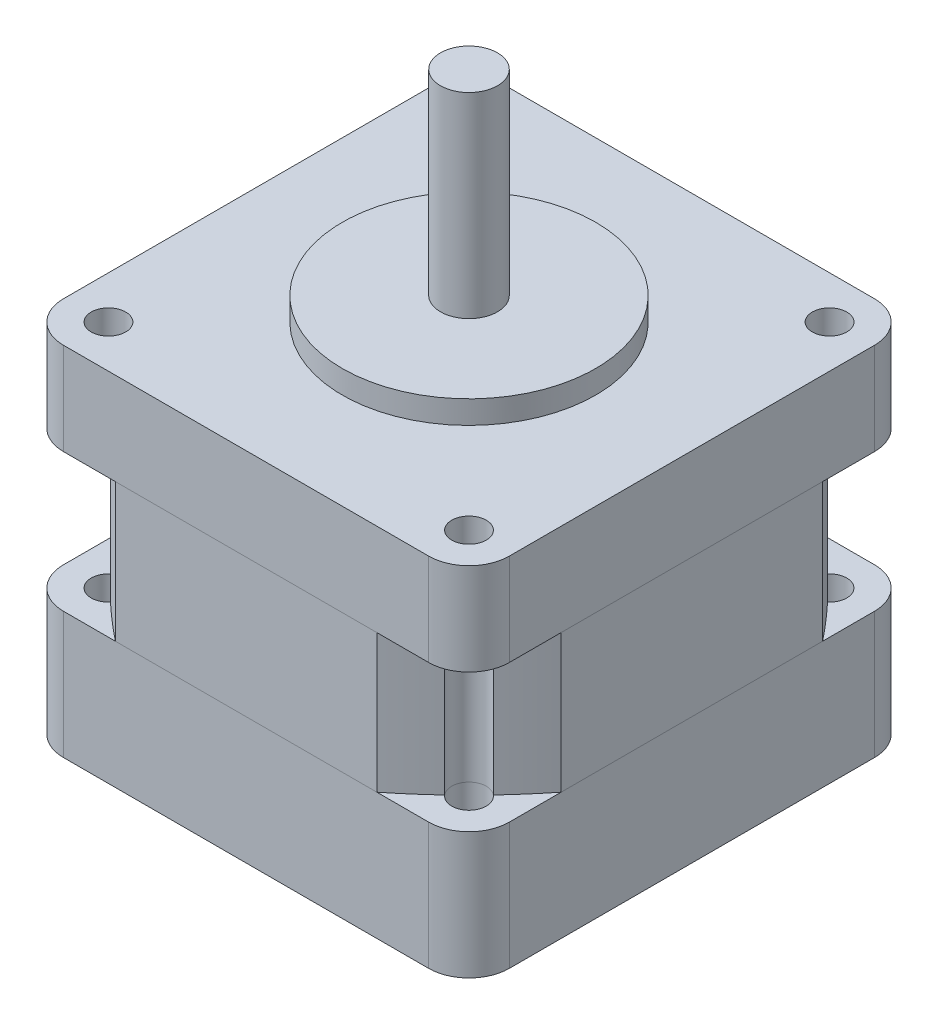
from build123d import *

# Parameters (mm, degrees)
SKETCH_1_W          = 38.7
SKETCH_1_H          = 38.7
EXTRUDE_1_DEPTH     = 11
SKETCH_2_W          = 38.7
SKETCH_2_H          = 38.7
EXTRUDE_2_DEPTH     = 12
SKETCH_3_W          = 38.7
SKETCH_3_H          = 38.7
EXTRUDE_3_DEPTH     = 8
CUT_EXTRUDE_1_DEPTH = 12
FILLET_1_R          = 3.5
FILLET_2_R          = 3.5
SKETCH_5_R          = 1.5
CUT_EXTRUDE_2_DEPTH = 42.350272067
SKETCH_6_R          = 11
EXTRUDE_4_DEPTH     = 2
SKETCH_7_R          = 2.475
EXTRUDE_5_DEPTH     = 17


with BuildPart() as part:
    # 스케치1 → 보스-돌출1 (new body)
    with BuildSketch(Plane(origin=(0, 0, 0), x_dir=(1, 0, 0), z_dir=(0, 1, 0))):
        Rectangle(SKETCH_1_W, SKETCH_1_H)
    extrude(amount=EXTRUDE_1_DEPTH)

    # 필렛2
    fillet_2_edges = [part.edges().sort_by_distance(p)[0] for p in [
        (19.35, 5.5, 19.35),
        (-19.35, 5.5, 19.35),
        (-19.35, 5.5, -19.35),
        (19.35, 5.5, -19.35),
    ]]
    fillet(fillet_2_edges, radius=FILLET_2_R)


with BuildPart() as body_2:
    # 스케치2 → 보스-돌출2 (new body)
    with BuildSketch(Plane(origin=(0, 11, 0), x_dir=(1, 0, 0), z_dir=(0, 1, 0))):
        Rectangle(SKETCH_2_W, SKETCH_2_H)
    extrude(amount=EXTRUDE_2_DEPTH)

    # 스케치4 → 컷-돌출1 (cut)
    with BuildSketch(Plane(origin=(0, 23, 0), x_dir=(1, 0, 0), z_dir=(0, 1, 0))):
        with BuildLine():
            Line((19.35, 11.35), (19.35, 19.35))
            Line((19.35, 19.35), (11.35, 19.35))
            ThreePointArc((11.35, 19.35), (15.579786716, 15.579786716), (19.35, 11.35))
        make_face()
        with BuildLine():
            Line((19.35, -11.35), (19.35, -19.35))
            Line((19.35, -19.35), (11.35, -19.35))
            ThreePointArc((11.35, -19.35), (15.579786716, -15.579786716), (19.35, -11.35))
        make_face()
        with BuildLine():
            Line((-19.35, -11.35), (-19.35, -19.35))
            Line((-19.35, -19.35), (-11.35, -19.35))
            ThreePointArc((-11.35, -19.35), (-15.579786716, -15.579786716), (-19.35, -11.35))
        make_face()
        with BuildLine():
            Line((-19.35, 11.35), (-19.35, 19.35))
            Line((-19.35, 19.35), (-11.35, 19.35))
            ThreePointArc((-11.35, 19.35), (-15.579786716, 15.579786716), (-19.35, 11.35))
        make_face()
    extrude(amount=-CUT_EXTRUDE_1_DEPTH, mode=Mode.SUBTRACT)


with BuildPart() as body_3:
    # 스케치3 → 보스-돌출3 (new body)
    with BuildSketch(Plane(origin=(0, 23, 0), x_dir=(1, 0, 0), z_dir=(0, 1, 0))):
        Rectangle(SKETCH_3_W, SKETCH_3_H)
    extrude(amount=EXTRUDE_3_DEPTH)

    # 필렛1
    fillet_1_edges = [body_3.edges().sort_by_distance(p)[0] for p in [
        (19.35, 27, 19.35),
        (-19.35, 27, 19.35),
        (-19.35, 27, -19.35),
        (19.35, 27, -19.35),
    ]]
    fillet(fillet_1_edges, radius=FILLET_1_R)


with BuildPart() as cut_extrude_2_tool:
    # 스케치5 → 컷-돌출2 (new, through all)
    with BuildSketch(Plane(origin=(0, 31, 0), x_dir=(1, 0, 0), z_dir=(0, 1, 0))):
        with Locations(Location((15.65, 15.65, 0), (0, 0, 270))):
            Circle(SKETCH_5_R)
        with Locations(Location((-15.65, 15.65, 0), (0, 0, 270))):
            Circle(SKETCH_5_R)
        with Locations(Location((-15.65, -15.65, 0), (0, 0, 270))):
            Circle(SKETCH_5_R)
        with Locations(Location((15.65, -15.65, 0), (0, 0, 270))):
            Circle(SKETCH_5_R)
    extrude(amount=-CUT_EXTRUDE_2_DEPTH)


with BuildPart() as part_1:
    add(part.part)

    # 컷-돌출2: cut by cut_extrude_2_tool
    add(cut_extrude_2_tool.part, mode=Mode.SUBTRACT)


with BuildPart() as body_2_1:
    add(body_2.part)

    # 컷-돌출2: cut by cut_extrude_2_tool
    add(cut_extrude_2_tool.part, mode=Mode.SUBTRACT)


with BuildPart() as body_3_1:
    add(body_3.part)

    # 컷-돌출2: cut by cut_extrude_2_tool
    add(cut_extrude_2_tool.part, mode=Mode.SUBTRACT)

    # 스케치6 → 보스-돌출4 (add)
    with BuildSketch(Plane(origin=(0, 31, 0), x_dir=(1, 0, 0), z_dir=(0, 1, 0))):
        with Locations(Location((0, 0, 0), (0, 0, 90))):
            Circle(SKETCH_6_R)
    extrude(amount=EXTRUDE_4_DEPTH)

    # 스케치7 → 보스-돌출5 (add)
    with BuildSketch(Plane(origin=(0, 33, 0), x_dir=(1, 0, 0), z_dir=(0, 1, 0))):
        with Locations(Location((0, 0, 0), (0, 0, 270))):
            Circle(SKETCH_7_R)
    extrude(amount=EXTRUDE_5_DEPTH)


solid = Compound([part_1.part, body_2_1.part, body_3_1.part])
